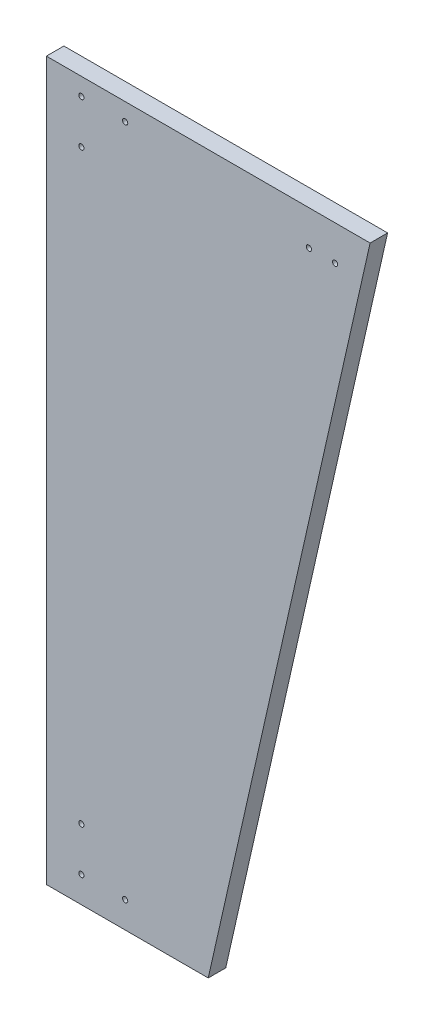
from build123d import *

# Parameters (mm, degrees)
EXTRUDE_1_DEPTH     = 10
SKETCH_2_R          = 1.5
CUT_EXTRUDE_1_DEPTH = 10
SKETCH_3_R          = 1.5
CUT_EXTRUDE_2_DEPTH = 10


with BuildPart() as part:
    # 草图1 → 凸台-拉伸1 (new body)
    with BuildSketch(Plane.XY):
        Polygon((185, 0), (0, 0), (0, -400), (0, -410), (92.5, -410), align=None)
    extrude(amount=EXTRUDE_1_DEPTH)

    # 草图2 → 切除-拉伸1 (cut)
    with BuildSketch(Plane.XY.offset(10)):
        with Locations((20, -35)):
            Circle(SKETCH_2_R)
        with Locations((45, -10)):
            Circle(SKETCH_2_R)
        with Locations((20, -10)):
            Circle(SKETCH_2_R)
        with Locations((45, -395)):
            Circle(SKETCH_2_R)
        with Locations((20, -395)):
            Circle(SKETCH_2_R)
        with Locations((20, -370)):
            Circle(SKETCH_2_R)
    extrude(amount=-CUT_EXTRUDE_1_DEPTH, mode=Mode.SUBTRACT)

    # 草图3 → 切除-拉伸2 (cut)
    with BuildSketch(Plane(origin=(0, 0, 0), x_dir=(-1, 0, 0), z_dir=(0, 0, -1))):
        with Locations((-165, -20)):
            Circle(SKETCH_3_R)
        with Locations((-150, -20)):
            Circle(SKETCH_3_R)
    extrude(amount=-CUT_EXTRUDE_2_DEPTH, mode=Mode.SUBTRACT)


solid = part.part
